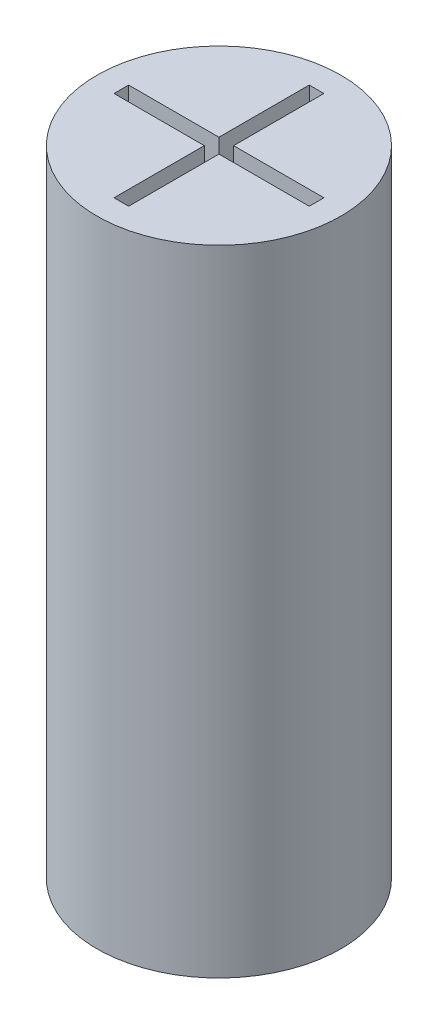
from build123d import *

# Parameters (mm, degrees)
SKETCH2_R           = 2.5
BOSS_EXTRUDE1_DEPTH = 13
SKETCH3_W           = 1.85
SKETCH3_H           = 0.3
SKETCH3_W_2         = 0.3
SKETCH3_H_2         = 1.85
CUT_EXTRUDE1_DEPTH  = 1


with BuildPart() as part:
    # Sketch2 → Boss-Extrude1 (new body)
    with BuildSketch(Plane(origin=(0, 0, 0), x_dir=(1, 0, 0), z_dir=(0, 1, 0))):
        with Locations(Location((0, 0, 0), (0, 0, 90))):
            Circle(SKETCH2_R)
    extrude(amount=BOSS_EXTRUDE1_DEPTH)

    # Sketch3 → Cut-Extrude1 (cut)
    with BuildSketch(Plane(origin=(0, 13, 0), x_dir=(1, 0, 0), z_dir=(0, 1, 0))):
        with Locations((1.075, 0)):
            Rectangle(SKETCH3_W, SKETCH3_H)
        Rectangle(SKETCH3_W_2, SKETCH3_H)
        with Locations((-1.075, 0)):
            Rectangle(SKETCH3_W, SKETCH3_H)
        with Locations((0, 1.075)):
            Rectangle(SKETCH3_W_2, SKETCH3_H_2)
        with Locations((0, -1.075)):
            Rectangle(SKETCH3_W_2, SKETCH3_H_2)
    extrude(amount=-CUT_EXTRUDE1_DEPTH, mode=Mode.SUBTRACT)


solid = part.part
